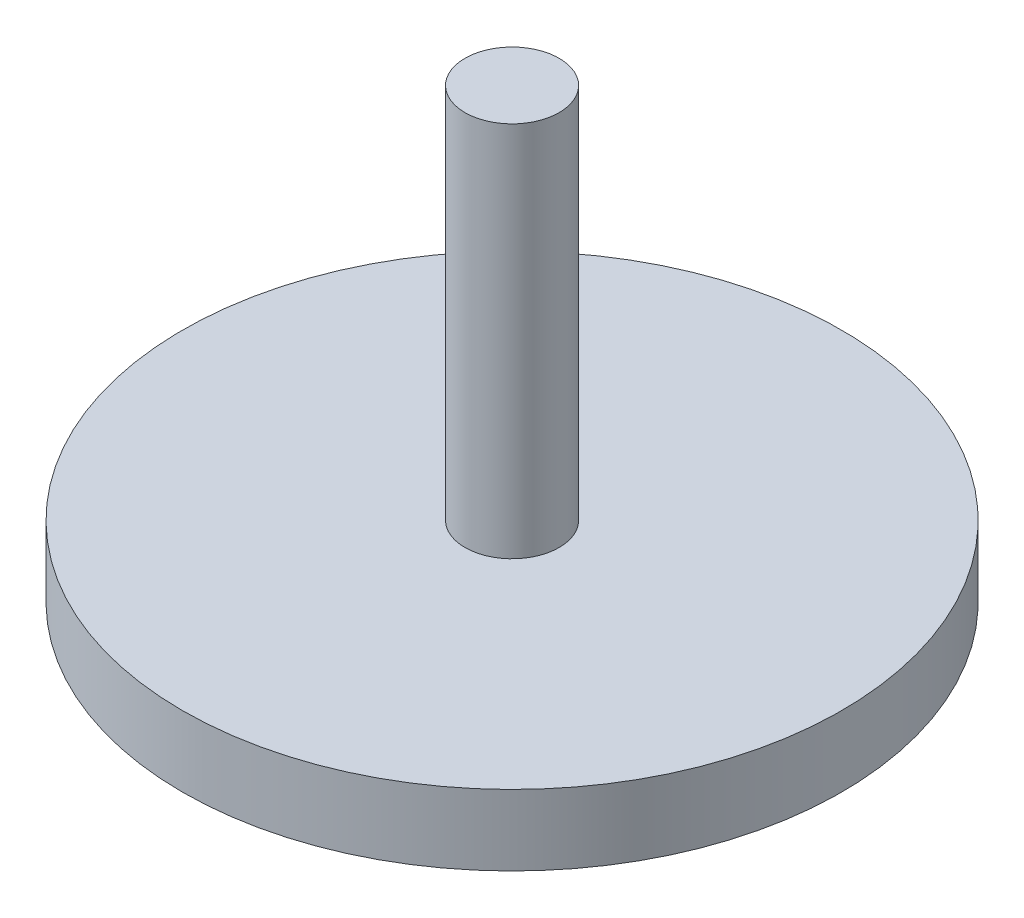
from build123d import *

# Parameters (mm, degrees)
SKETCH_1_R      = 7
EXTRUDE_1_DEPTH = 1.5
SKETCH_2_R      = 1
EXTRUDE_2_DEPTH = 8


with BuildPart() as part:
    # 草图1 → 凸台-拉伸1 (new body)
    with BuildSketch(Plane(origin=(0, 0, 0), x_dir=(1, 0, 0), z_dir=(0, 1, 0))):
        with Locations(Location((0, 0, 0), (0, 0, 270))):
            Circle(SKETCH_1_R)
    extrude(amount=EXTRUDE_1_DEPTH)

    # 草图2 → 凸台-拉伸2 (add)
    with BuildSketch(Plane(origin=(0, 1.5, 0), x_dir=(1, 0, 0), z_dir=(0, 1, 0))):
        with Locations(Location((0, 0, 0), (0, 0, 270))):
            Circle(SKETCH_2_R)
    extrude(amount=EXTRUDE_2_DEPTH)


solid = part.part
